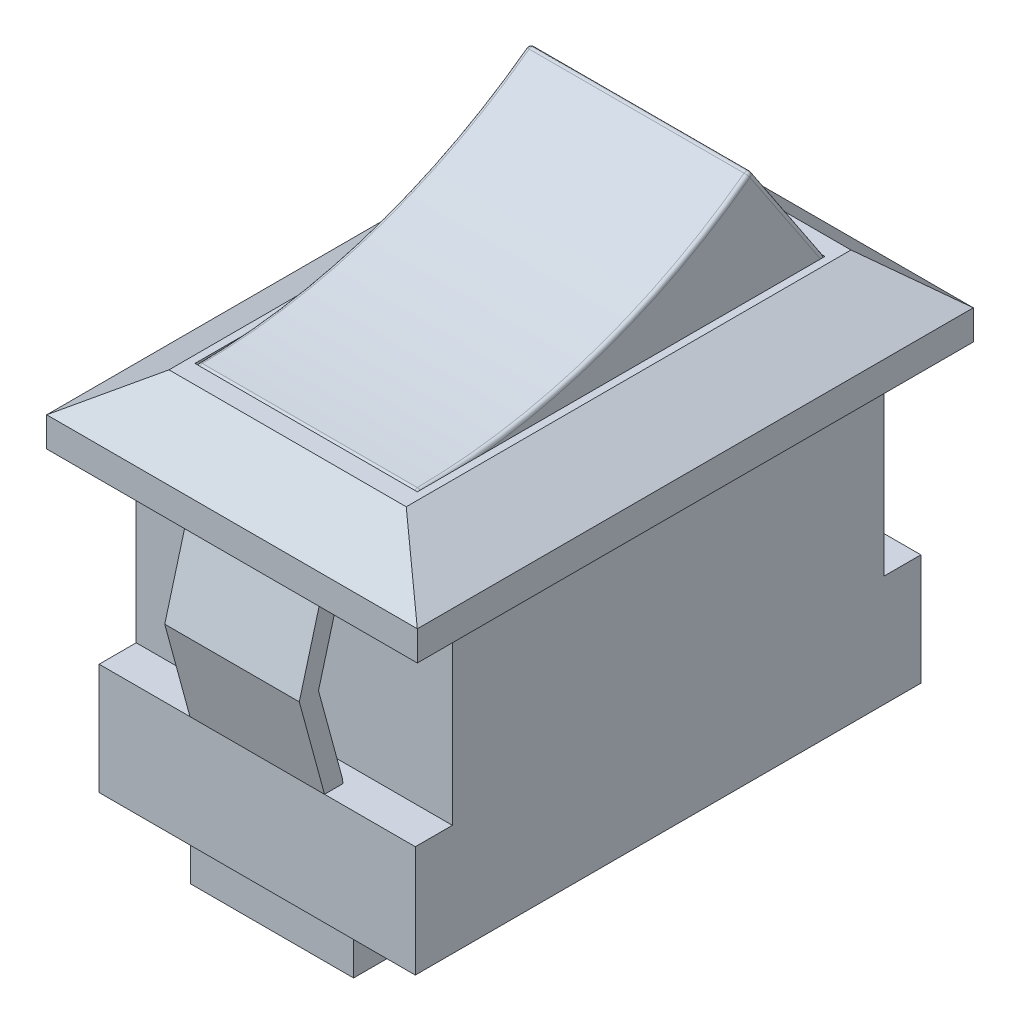
from build123d import *

# Parameters (mm, degrees)
SKETCH1_W           = 8.53
SKETCH1_H           = 13.64
BOSS_EXTRUDE1_DEPTH = 10
SKETCH2_W           = 1
SKETCH2_H           = 5
CUT_EXTRUDE1_DEPTH  = 15.807879659
SKETCH3_W           = 6
SKETCH3_H           = 11
CUT_EXTRUDE2_DEPTH  = 0.5
BOSS_EXTRUDE2_START = -2
SKETCH4_W           = 10
SKETCH4_H           = 15
SKETCH4_W_2         = 8.53
SKETCH4_H_2         = 13.64
SKETCH4_W_3         = 6
SKETCH4_H_3         = 11
BOSS_EXTRUDE2_DEPTH = 2
CHAMFER1_SIZE       = 1.5
CHAMFER1_SIZE2      = 1.2
CHAMFER2_SIZE       = 1.2
CHAMFER2_SIZE2      = 1.5
CHAMFER3_SIZE       = 1.8
CHAMFER3_SIZE2      = 1.2
CHAMFER4_SIZE       = 1.2
CHAMFER4_SIZE2      = 1.8
BOSS_EXTRUDE3_DEPTH = 1.815
SKETCH7_W           = 7
SKETCH7_H           = 2.5
BOSS_EXTRUDE4_DEPTH = 0.3
BOSS_EXTRUDE5_DEPTH = 1
SKETCH8_5_W         = 5
SKETCH8_5_H         = 0.4
SKETCH8_5_W_2       = 3.4
SKETCH8_5_H_2       = 1.5
CUT_EXTRUDE4_DEPTH  = 1
BOSS_EXTRUDE6_DEPTH = 0.15
LPATTERN1_COUNT     = 2
LPATTERN1_PITCH     = 5.1725
BOSS_EXTRUDE7_DEPTH = 3
FILLET1_R           = 0.1
SKETCH12_W          = 12.226459424
SKETCH12_H          = 6.113229712
CUT_EXTRUDE5_DEPTH  = 19.902309573


with BuildPart() as part:
    # Sketch1 → Boss-Extrude1 (new body)
    with BuildSketch(Plane(origin=(0, 0, 0), x_dir=(1, 0, 0), z_dir=(0, 1, 0))):
        Rectangle(SKETCH1_W, SKETCH1_H)
    extrude(amount=BOSS_EXTRUDE1_DEPTH)

    # Sketch2 → Cut-Extrude1 (cut, through all)
    with BuildSketch(Plane.ZY.offset(4.265)):
        with Locations((-6.32, 5.5)):
            Rectangle(SKETCH2_W, SKETCH2_H)
        with Locations((6.32, 5.5)):
            Rectangle(SKETCH2_W, SKETCH2_H)
    extrude(amount=-CUT_EXTRUDE1_DEPTH, mode=Mode.SUBTRACT)

    # Sketch3 → Cut-Extrude2 (cut)
    with BuildSketch(Plane(origin=(0, 10, 0), x_dir=(1, 0, 0), z_dir=(0, 1, 0))):
        Rectangle(SKETCH3_W, SKETCH3_H)
    extrude(amount=-CUT_EXTRUDE2_DEPTH, mode=Mode.SUBTRACT)

    # Sketch4 → Boss-Extrude2 (add)
    # profile 1 of 2: a face of its own
    with BuildSketch(Plane(origin=(0, 10, 0), x_dir=(1, 0, 0), z_dir=(0, 1, 0)).offset(BOSS_EXTRUDE2_START)):
        Rectangle(SKETCH4_W, SKETCH4_H)
        Rectangle(SKETCH4_W_2, SKETCH4_H_2, mode=Mode.SUBTRACT)
    # profile 2 of 2: a face of its own
    with BuildSketch(Plane(origin=(0, 10, 0), x_dir=(1, 0, 0), z_dir=(0, 1, 0)).offset(BOSS_EXTRUDE2_START)):
        Rectangle(SKETCH4_W_2, SKETCH4_H_2)
        Rectangle(SKETCH4_W_3, SKETCH4_H_3, mode=Mode.SUBTRACT)
    extrude(amount=BOSS_EXTRUDE2_DEPTH)

    # Chamfer1
    chamfer1_edges = [part.edges().sort_by_distance(p)[0] for p in [
        (0, 10, 7.5),
    ]]
    chamfer1_side = [part.faces().sort_by_distance(p)[0] for p in [
        (-4.819722436, 10, 0),
    ]]
    chamfer(chamfer1_edges, length=CHAMFER1_SIZE, length2=CHAMFER1_SIZE2, reference=chamfer1_side[0])

    # Chamfer2
    chamfer2_edges = [part.edges().sort_by_distance(p)[0] for p in [
        (0, 10, -7.5),
    ]]
    chamfer2_side = [part.faces().sort_by_distance(p)[0] for p in [
        (0, 9, -7.5),
    ]]
    chamfer(chamfer2_edges, length=CHAMFER2_SIZE, length2=CHAMFER2_SIZE2, reference=chamfer2_side[0])

    # Chamfer3
    chamfer3_edges = [part.edges().sort_by_distance(p)[0] for p in [
        (-5, 10, 0),
    ]]
    chamfer3_side = [part.faces().sort_by_distance(p)[0] for p in [
        (-4.843795006, 10, 0),
    ]]
    chamfer(chamfer3_edges, length=CHAMFER3_SIZE, length2=CHAMFER3_SIZE2, reference=chamfer3_side[0])

    # Chamfer4
    chamfer4_edges = [part.edges().sort_by_distance(p)[0] for p in [
        (5, 10, 0),
    ]]
    chamfer4_side = [part.faces().sort_by_distance(p)[0] for p in [
        (5, 8.961702128, 0),
    ]]
    chamfer(chamfer4_edges, length=CHAMFER4_SIZE, length2=CHAMFER4_SIZE2, reference=chamfer4_side[0])

    # Sketch6 → Boss-Extrude3 (add, symmetric)
    with BuildSketch(Plane(origin=(0, 0, 0), x_dir=(0, 0, -1), z_dir=(1, 0, 0))):
        Polygon((-6.82, 8), (-7.5, 5.5), (-6.82, 3), (-6.32, 3), (-6.337529128, 3.131232077), (-6.981834003, 5.5), (-6.337529128, 7.868767923), (-6.337529128, 8), align=None)
        Polygon((6.32, 3), (6.82, 3), (7.5, 5.5), (6.82, 8), (6.337529128, 8), (6.337529128, 7.868767923), (6.981834003, 5.5), (6.337529128, 3.131232077), align=None)
    extrude(amount=BOSS_EXTRUDE3_DEPTH, both=True)

    # Sketch7 → Boss-Extrude4 (add)
    with BuildSketch(Plane.XZ):
        Rectangle(SKETCH7_W, SKETCH7_H)
        with Locations((0, -5.17)):
            Rectangle(SKETCH7_W, SKETCH7_H)
        with Locations((0, 5.17)):
            Rectangle(SKETCH7_W, SKETCH7_H)
    extrude(amount=BOSS_EXTRUDE4_DEPTH)

    # Sketch8 → Boss-Extrude5 (add)
    with BuildSketch(Plane.XZ.offset(0.3)):
        Polygon((1.7, 5.37), (2.2, 5.37), (2.2, 6.42), (-2.2, 6.42), (-2.2, 5.37), (-1.7, 5.37), (-1.7, 5.92), (1.7, 5.92), align=None)
        Polygon((-2.2, 3.92), (2.2, 3.92), (2.2, 4.97), (1.7, 4.97), (1.7, 4.42), (-1.7, 4.42), (-1.7, 4.97), (-2.2, 4.97), align=None)
        Polygon((1.7, 0.2), (2.2, 0.2), (2.2, 1.25), (-2.2, 1.25), (-2.2, 0.2), (-1.7, 0.2), (-1.7, 0.75), (1.7, 0.75), align=None)
        Polygon((-2.2, -1.25), (2.2, -1.25), (2.2, -0.2), (1.7, -0.2), (1.7, -0.75), (-1.7, -0.75), (-1.7, -0.2), (-2.2, -0.2), align=None)
        Polygon((1.7, -4.97), (2.2, -4.97), (2.2, -3.92), (-2.2, -3.92), (-2.2, -4.97), (-1.7, -4.97), (-1.7, -4.42), (1.7, -4.42), align=None)
        Polygon((-2.2, -6.42), (2.2, -6.42), (2.2, -5.37), (1.7, -5.37), (1.7, -5.92), (-1.7, -5.92), (-1.7, -5.37), (-2.2, -5.37), align=None)
    extrude(amount=BOSS_EXTRUDE5_DEPTH)

    # Sketch8<5> → Cut-Extrude4 (cut)
    with BuildSketch(Plane.XZ.offset(0.3)):
        Rectangle(SKETCH8_5_W, SKETCH8_5_H)
        with Locations((0, -5.17)):
            Rectangle(SKETCH8_5_W, SKETCH8_5_H)
        with Locations((0, 5.17)):
            Rectangle(SKETCH8_5_W, SKETCH8_5_H)
        with Locations((0, 5.17)):
            Rectangle(SKETCH8_5_W_2, SKETCH8_5_H_2)
        Rectangle(SKETCH8_5_W_2, SKETCH8_5_H_2)
        with Locations((0, -5.17)):
            Rectangle(SKETCH8_5_W_2, SKETCH8_5_H_2)
    extrude(amount=-CUT_EXTRUDE4_DEPTH, mode=Mode.SUBTRACT)

    # Sketch10 → Boss-Extrude6 (add, symmetric)
    # profile 1 of 2: a face of its own
    with BuildSketch(Plane.XY):
        Polygon((1.85, -1.65), (1.85, -1.3), (-1.85, -1.3), (-1.85, -1.65), (-1.85, -6.5), (-1.35, -7), (1.35, -7), (1.85, -6.5), align=None)
        with BuildLine():
            ThreePointArc((0.5, -5.5), (0, -6), (-0.5, -5.5))
            Line((-0.5, -5.5), (-0.5, -3.7))
            ThreePointArc((-0.5, -3.7), (0, -3.2), (0.5, -3.7))
            Line((0.5, -3.7), (0.5, -5.5))
        make_face(mode=Mode.SUBTRACT)
    # profile 2 of 2: a face of its own
    with BuildSketch(Plane.XY):
        Polygon((2.5, 0), (1.85, 0), (-1.85, 0), (-2.5, 0), (-2.5, -0.3), (-2.2, -0.3), (-2.2, -1.3), (-1.85, -1.3), (1.85, -1.3), (2.2, -1.3), (2.2, -0.3), (2.5, -0.3), align=None)
    boss_extrude6 = extrude(amount=BOSS_EXTRUDE6_DEPTH, both=True)

    # LPattern1: Boss-Extrude6 ×2
    with Locations(*[(0, 0, -i * LPATTERN1_PITCH) for i in range(1, LPATTERN1_COUNT)]):
        add(boss_extrude6)

    # Sketch12 → Cut-Extrude5 (cut, through all)
    with BuildSketch(Plane(origin=(0, 0, -5.3225), x_dir=(-1, 0, 0), z_dir=(0, 0, -1))):
        with Locations((0.605815557, -5.056614856)):
            Rectangle(SKETCH12_W, SKETCH12_H)
    extrude(amount=-CUT_EXTRUDE5_DEPTH, mode=Mode.SUBTRACT)


with BuildPart() as body_2:
    # Sketch11 → Boss-Extrude7 (new, symmetric)
    with BuildSketch(Plane(origin=(0, 0, 0), x_dir=(0, 0, -1), z_dir=(1, 0, 0))):
        with BuildLine():
            Line((5.5, 9.5), (-5.5, 9.5))
            Line((-5.5, 9.5), (-5.5, 9.900331129))
            ThreePointArc((-5.5, 9.900331129), (-5.470944433, 9.970807277), (-5.400662252, 10.000328937))
            ThreePointArc((-5.400662252, 10.000328937), (-0.759264413, 10.768857175), (3.415788118, 12.937300375))
            ThreePointArc((3.415788118, 12.937300375), (3.492454919, 12.955387143), (3.558431735, 12.912352398))
            Line((3.558431735, 12.912352398), (5.483205029, 10.025192456))
            ThreePointArc((5.483205029, 10.025192456), (5.495709203, 9.998700851), (5.5, 9.969722436))
            Line((5.5, 9.969722436), (5.5, 9.5))
        make_face()
    extrude(amount=BOSS_EXTRUDE7_DEPTH, both=True)

    # Fillet1
    fillet1_edges = [body_2.edges().sort_by_distance(p)[0] for p in [
        (-3, 12.955387143, -3.492454919),
        (-3, 11.468772427, -4.520818382),
        (-3, 9.998700851, -5.495709203),
        (-3, 9.734861218, -5.5),
        (3, 11.468772427, -4.520818382),
        (3, 12.955387143, -3.492454919),
        (3, 10.768857175, 0.759264413),
        (3, 9.970807277, 5.470944433),
        (3, 9.700165565, 5.5),
        (3, 9.734861218, -5.5),
        (3, 9.998700851, -5.495709203),
        (-3, 9.700165565, 5.5),
        (-3, 9.970807277, 5.470944433),
        (-3, 10.768857175, 0.759264413),
    ]]
    fillet(fillet1_edges, radius=FILLET1_R)


solid = Compound([part.part, body_2.part])
